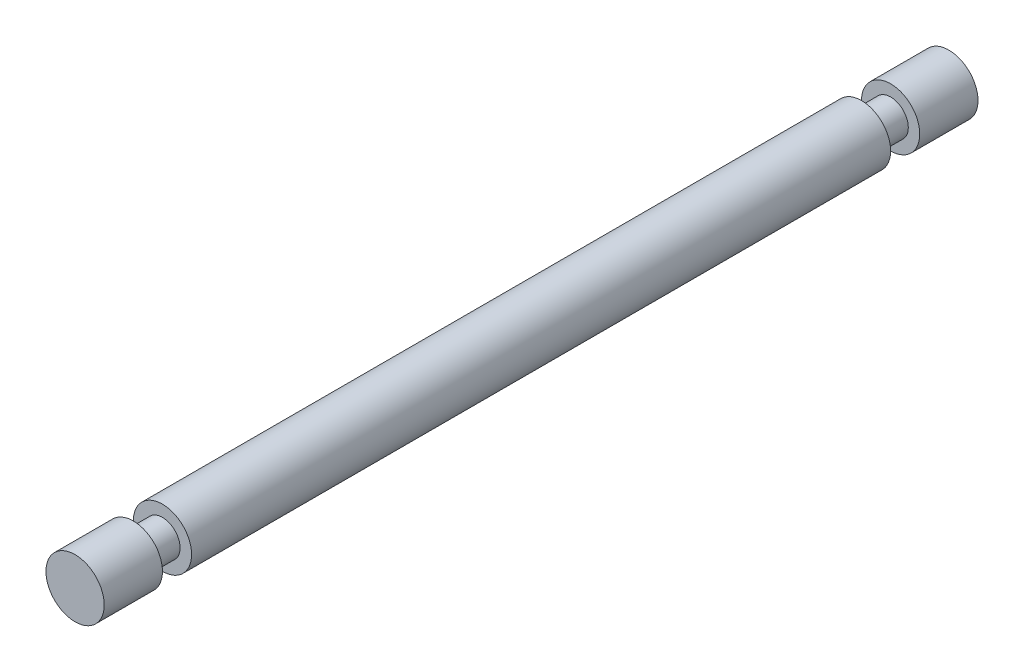
from build123d import *

# Parameters (mm, degrees)
SKETCH2_W = 1.27
SKETCH2_H = 38.1
SKETCH3_W = 0.499412869
SKETCH3_H = 1.27


with BuildPart() as part:
    # Sketch2 → Revolve1 (revolve)
    with BuildSketch(Plane(origin=(0, 0, 0), x_dir=(1, 0, 0), z_dir=(0, 1, 0))):
        with Locations((0.635, 19.05)):
            Rectangle(SKETCH2_W, SKETCH2_H)
    revolve(axis=Axis((0, 0, 0), (0, 0, -1)))

    # Sketch3 → Cut-Revolve1 (revolve, cut)
    with BuildSketch(Plane(origin=(0, 0, 0), x_dir=(1, 0, 0), z_dir=(0, 1, 0))):
        with Locations((1.020293566, 3.175)):
            Rectangle(SKETCH3_W, SKETCH3_H)
    cut_revolve1 = revolve(axis=Axis((0, 0, 0), (0, 0, -1)), mode=Mode.SUBTRACT)

    # Mirror1: Cut-Revolve1 across plane
    add(cut_revolve1.mirror(Plane.XY.offset(-19.05)), mode=Mode.SUBTRACT)


solid = part.part
